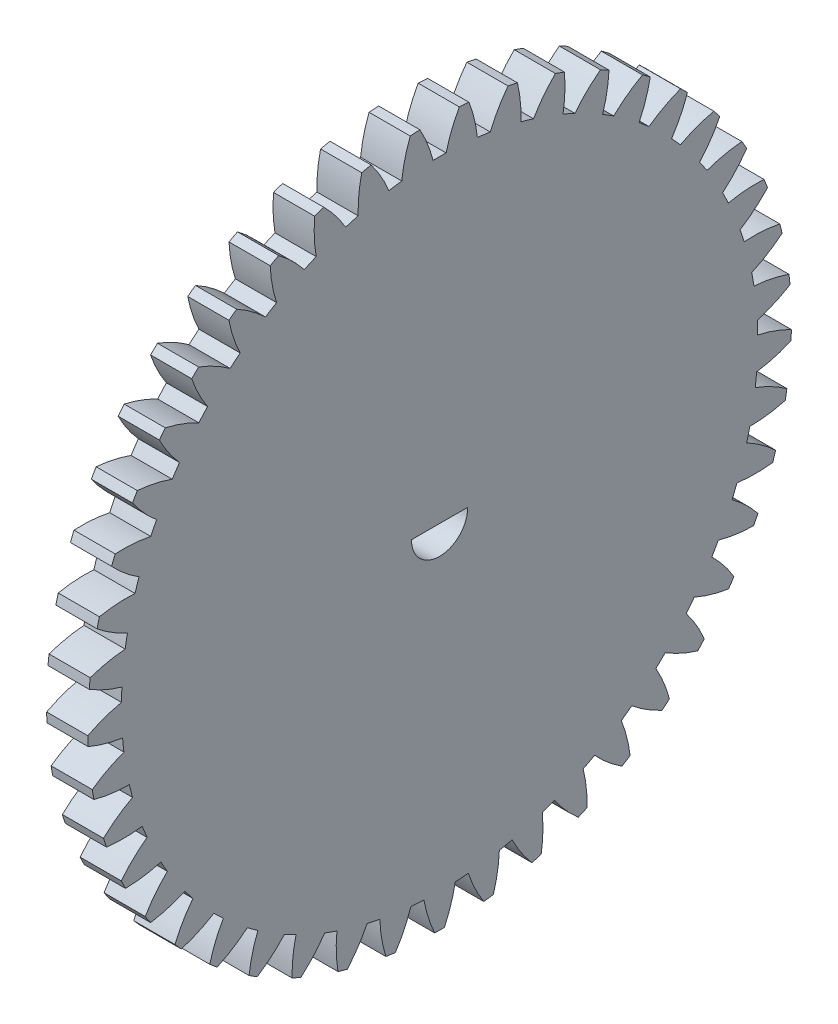
from build123d import *

# Parameters (mm, degrees)
BASPROSKE_W           = 5.5
BASPROSKE_H           = 47
TOOTHCUT_DEPTH        = 67.695202226
TEETHCUTS_COUNT       = 45
BORSKE_R              = 0.4
BORE_DEPTH            = 50.0000508
CORTAR_EXTRUIR1_DEPTH = 6


with BuildPart() as part:
    # BasProSke → Base-Revolve (revolve)
    with BuildSketch(Plane(origin=(0, 0, 0), x_dir=(1, 0, 0), z_dir=(0, 1, 0)), mode=Mode.PRIVATE) as base_revolve_sk:
        with Locations((2.75, 23.5)):
            Rectangle(BASPROSKE_W, BASPROSKE_H)
    revolve(base_revolve_sk.sketch.rotate(Axis((-10, 0, 0), (1, 0, 0)), 180), axis=Axis((-10, 0, 0), (1, 0, 0)))

    # TooCutSke → ToothCut (cut, through all)
    with BuildSketch(Plane(origin=(0, 0, 0), x_dir=(0, 0, -1), z_dir=(1, 0, 0))):
        with BuildLine():
            ThreePointArc((0.870558136, 42.49008272), (0, 42.499), (-0.870558136, 42.49008272))
            ThreePointArc((-0.870558136, 42.49008272), (-1.611306544, 44.779997814), (-2.650928503, 46.950621117))
            ThreePointArc((-2.650928503, 46.950621117), (0, 47.0254), (2.650928503, 46.950621117))
            ThreePointArc((2.650928503, 46.950621117), (1.611306544, 44.779997814), (0.870558136, 42.49008272))
        make_face()
    toothcut = extrude(amount=TOOTHCUT_DEPTH, mode=Mode.SUBTRACT)

    # TeethCuts: ToothCut ×45 about axis
    teethcuts_axis = Axis((0, 0, 0), (1, 0, 0))
    for i in range(1, TEETHCUTS_COUNT):
        add(toothcut.rotate(teethcuts_axis, i * 360 / TEETHCUTS_COUNT), mode=Mode.SUBTRACT)

    # BorSke → Bore (cut, symmetric)
    with BuildSketch(Plane(origin=(0, 0, 0), x_dir=(0, 0, -1), z_dir=(1, 0, 0))):
        with Locations(Location((0, -1.719992453, 0), (0, 0, 180))):
            Circle(BORSKE_R)
    extrude(amount=BORE_DEPTH, both=True, mode=Mode.SUBTRACT)

    # Croquis1 → Cortar-Extruir1 (cut)
    with BuildSketch(Plane(origin=(5.5, 0, 0), x_dir=(0, 0, -1), z_dir=(1, 0, 0))):
        with BuildLine():
            Line((3.749666652, 0.05), (-3.749666652, 0.05))
            ThreePointArc((-3.749666652, 0.05), (0, -3.75), (3.749666652, 0.05))
        make_face()
    extrude(amount=-CORTAR_EXTRUIR1_DEPTH, mode=Mode.SUBTRACT)


solid = part.part
